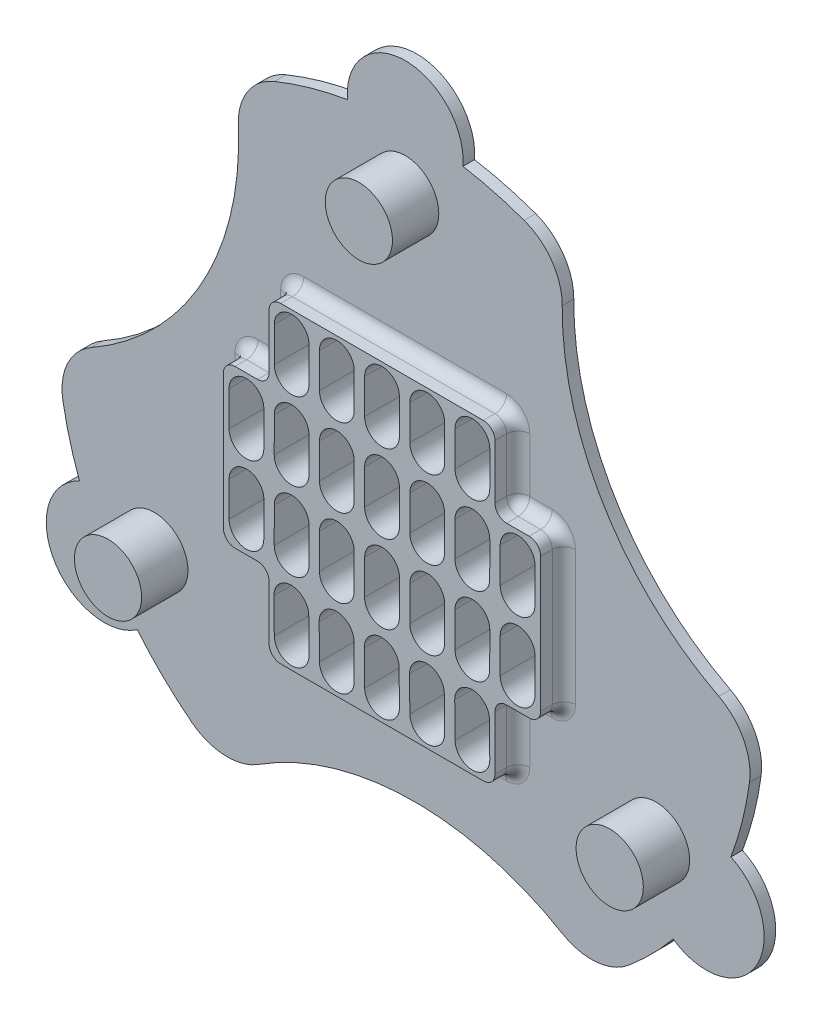
from build123d import *

# Parameters (mm, degrees)
SKETCH2_R           = 18.85
BOSS_EXTRUDE1_DEPTH = 1
SKETCH3_R           = 30
SKETCH3_R_2         = 17.600030795
BOSS_EXTRUDE2_DEPTH = 1
SKETCH4_R           = 2.9
BOSS_EXTRUDE3_DEPTH = 4
SKETCH6_R           = 5
BOSS_EXTRUDE4_DEPTH = 1
SKETCH7_R           = 25
CUT_EXTRUDE2_DEPTH  = 1
FILLET1_R           = 5
SKETCH2_2_R         = 18.85
BOSS_EXTRUDE5_DEPTH = 3
SKETCH8_R           = 20.511068925
CUT_EXTRUDE3_DEPTH  = 2
FILLET2_R           = 1
FILLET3_R           = 1


with BuildPart() as part:
    # Sketch2 → Boss-Extrude1 (new body)
    with BuildSketch(Plane.XY.offset(10)):
        Circle(SKETCH2_R)
        with BuildLine():
            Line((-6.300750604, 11.631897337), (-6.301949779, 8.631897576))
            ThreePointArc((-6.301949779, 8.631897576), (-7.802549247, 7.132497284), (-9.30194954, 8.633096752))
            Line((-9.30194954, 8.633096752), (-9.300750364, 11.633096512))
            ThreePointArc((-9.300750364, 11.633096512), (-7.800150896, 13.132496805), (-6.300750604, 11.631897337))
        make_face(mode=Mode.SUBTRACT)
        with BuildLine():
            Line((-5.400750364, 11.633096512), (-5.40194954, 8.633096752))
            ThreePointArc((-5.40194954, 8.633096752), (-3.902549247, 7.132497284), (-2.401949779, 8.631897576))
            Line((-2.401949779, 8.631897576), (-2.400750604, 11.631897337))
            ThreePointArc((-2.400750604, 11.631897337), (-3.900150896, 13.132496805), (-5.400750364, 11.633096512))
        make_face(mode=Mode.SUBTRACT)
        with BuildLine():
            Line((-1.500750364, 11.633096512), (-1.50194954, 8.633096752))
            ThreePointArc((-1.50194954, 8.633096752), (-0.002549247, 7.132497284), (1.498050221, 8.631897576))
            Line((1.498050221, 8.631897576), (1.499249396, 11.631897337))
            ThreePointArc((1.499249396, 11.631897337), (-0.000150896, 13.132496805), (-1.500750364, 11.633096512))
        make_face(mode=Mode.SUBTRACT)
        with BuildLine():
            Line((2.399249636, 11.633096512), (2.39805046, 8.633096752))
            ThreePointArc((2.39805046, 8.633096752), (3.897450753, 7.132497284), (5.398050221, 8.631897576))
            Line((5.398050221, 8.631897576), (5.399249396, 11.631897337))
            ThreePointArc((5.399249396, 11.631897337), (3.899849104, 13.132496805), (2.399249636, 11.633096512))
        make_face(mode=Mode.SUBTRACT)
        with BuildLine():
            Line((6.299249636, 11.633096512), (6.29805046, 8.633096752))
            ThreePointArc((6.29805046, 8.633096752), (7.797450753, 7.132497284), (9.298050221, 8.631897576))
            Line((9.298050221, 8.631897576), (9.299249396, 11.631897337))
            ThreePointArc((9.299249396, 11.631897337), (7.799849104, 13.132496805), (6.299249636, 11.633096512))
        make_face(mode=Mode.SUBTRACT)
        with BuildLine():
            Line((-10.203450815, 1.876748439), (-10.201950263, 4.876748439))
            ThreePointArc((-10.201950263, 4.876748439), (-11.701199799, 6.377498527), (-13.201949888, 4.878248991))
            Line((-13.201949888, 4.878248991), (-13.20345044, 1.878248991))
            ThreePointArc((-13.20345044, 1.878248991), (-11.704200903, 0.377498902), (-10.203450815, 1.876748439))
        make_face(mode=Mode.SUBTRACT)
        with BuildLine():
            Line((-9.303450024, 1.878248991), (-9.301949472, 4.878248991))
            ThreePointArc((-9.301949472, 4.878248991), (-7.801199384, 6.377498527), (-6.301949847, 4.876748439))
            Line((-6.301949847, 4.876748439), (-6.3034504, 1.876748439))
            ThreePointArc((-6.3034504, 1.876748439), (-7.804200488, 0.377498902), (-9.303450024, 1.878248991))
        make_face(mode=Mode.SUBTRACT)
        with BuildLine():
            Line((-2.4034504, 1.876748439), (-2.401949847, 4.876748439))
            ThreePointArc((-2.401949847, 4.876748439), (-3.901199384, 6.377498527), (-5.401949472, 4.878248991))
            Line((-5.401949472, 4.878248991), (-5.403450024, 1.878248991))
            ThreePointArc((-5.403450024, 1.878248991), (-3.904200488, 0.377498902), (-2.4034504, 1.876748439))
        make_face(mode=Mode.SUBTRACT)
        with BuildLine():
            Line((1.4965496, 1.876748439), (1.498050153, 4.876748439))
            ThreePointArc((1.498050153, 4.876748439), (-0.001199384, 6.377498527), (-1.501949472, 4.878248991))
            Line((-1.501949472, 4.878248991), (-1.503450024, 1.878248991))
            ThreePointArc((-1.503450024, 1.878248991), (-0.004200488, 0.377498902), (1.4965496, 1.876748439))
        make_face(mode=Mode.SUBTRACT)
        with BuildLine():
            Line((5.3965496, 1.876748439), (5.398050153, 4.876748439))
            ThreePointArc((5.398050153, 4.876748439), (3.898800616, 6.377498527), (2.398050528, 4.878248991))
            Line((2.398050528, 4.878248991), (2.396549976, 1.878248991))
            ThreePointArc((2.396549976, 1.878248991), (3.895799512, 0.377498902), (5.3965496, 1.876748439))
        make_face(mode=Mode.SUBTRACT)
        with BuildLine():
            Line((9.2965496, 1.876748439), (9.298050153, 4.876748439))
            ThreePointArc((9.298050153, 4.876748439), (7.798800616, 6.377498527), (6.298050528, 4.878248991))
            Line((6.298050528, 4.878248991), (6.296549976, 1.878248991))
            ThreePointArc((6.296549976, 1.878248991), (7.795799512, 0.377498902), (9.2965496, 1.876748439))
        make_face(mode=Mode.SUBTRACT)
        with BuildLine():
            Line((13.1965496, 1.876748439), (13.198050153, 4.876748439))
            ThreePointArc((13.198050153, 4.876748439), (11.698800616, 6.377498527), (10.198050528, 4.878248991))
            Line((10.198050528, 4.878248991), (10.196549976, 1.878248991))
            ThreePointArc((10.196549976, 1.878248991), (11.695799512, 0.377498902), (13.1965496, 1.876748439))
        make_face(mode=Mode.SUBTRACT)
        with BuildLine():
            Line((-9.304647729, -4.877109305), (-9.30074961, -1.877109305))
            ThreePointArc((-9.30074961, -1.877109305), (-7.798801818, -0.37905963), (-6.300752142, -1.881007421))
            Line((-6.300752142, -1.881007421), (-6.304650262, -4.881007421))
            ThreePointArc((-6.304650262, -4.881007421), (-7.806598054, -6.379057097), (-9.304647729, -4.877109305))
        make_face(mode=Mode.SUBTRACT)
        with BuildLine():
            Line((-2.404650262, -4.881007421), (-2.400752142, -1.881007421))
            ThreePointArc((-2.400752142, -1.881007421), (-3.898801818, -0.37905963), (-5.40074961, -1.877109305))
            Line((-5.40074961, -1.877109305), (-5.404647729, -4.877109305))
            ThreePointArc((-5.404647729, -4.877109305), (-3.906598054, -6.379057097), (-2.404650262, -4.881007421))
        make_face(mode=Mode.SUBTRACT)
        with BuildLine():
            Line((1.495349738, -4.881007421), (1.499247858, -1.881007421))
            ThreePointArc((1.499247858, -1.881007421), (0.001198182, -0.37905963), (-1.50074961, -1.877109305))
            Line((-1.50074961, -1.877109305), (-1.504647729, -4.877109305))
            ThreePointArc((-1.504647729, -4.877109305), (-0.006598054, -6.379057097), (1.495349738, -4.881007421))
        make_face(mode=Mode.SUBTRACT)
        with BuildLine():
            Line((5.395349738, -4.881007421), (5.399247858, -1.881007421))
            ThreePointArc((5.399247858, -1.881007421), (3.901198182, -0.37905963), (2.39925039, -1.877109305))
            Line((2.39925039, -1.877109305), (2.395352271, -4.877109305))
            ThreePointArc((2.395352271, -4.877109305), (3.893401946, -6.379057097), (5.395349738, -4.881007421))
        make_face(mode=Mode.SUBTRACT)
        with BuildLine():
            Line((9.295349738, -4.881007421), (9.299247858, -1.881007421))
            ThreePointArc((9.299247858, -1.881007421), (7.801198182, -0.37905963), (6.29925039, -1.877109305))
            Line((6.29925039, -1.877109305), (6.295352271, -4.877109305))
            ThreePointArc((6.295352271, -4.877109305), (7.793401946, -6.379057097), (9.295349738, -4.881007421))
        make_face(mode=Mode.SUBTRACT)
        with BuildLine():
            Line((13.195349738, -4.881007421), (13.199247858, -1.881007421))
            ThreePointArc((13.199247858, -1.881007421), (11.701198182, -0.37905963), (10.19925039, -1.877109305))
            Line((10.19925039, -1.877109305), (10.195352271, -4.877109305))
            ThreePointArc((10.195352271, -4.877109305), (11.693401946, -6.379057097), (13.195349738, -4.881007421))
        make_face(mode=Mode.SUBTRACT)
        with BuildLine():
            Line((-10.204650262, -4.881007421), (-10.200752142, -1.881007421))
            ThreePointArc((-10.200752142, -1.881007421), (-11.698801818, -0.37905963), (-13.20074961, -1.877109305))
            Line((-13.20074961, -1.877109305), (-13.204647729, -4.877109305))
            ThreePointArc((-13.204647729, -4.877109305), (-11.706598054, -6.379057097), (-10.204650262, -4.881007421))
        make_face(mode=Mode.SUBTRACT)
        with BuildLine():
            Line((-6.325942117, -8.623046013), (-6.300802019, -11.623046013))
            ThreePointArc((-6.300802019, -11.623046013), (-7.788179745, -13.135562955), (-9.300696687, -11.648185229))
            Line((-9.300696687, -11.648185229), (-9.325836785, -8.648185229))
            ThreePointArc((-9.325836785, -8.648185229), (-7.838459059, -7.135668287), (-6.325942117, -8.623046013))
        make_face(mode=Mode.SUBTRACT)
        with BuildLine():
            Line((-5.425836785, -8.648185229), (-5.400696687, -11.648185229))
            ThreePointArc((-5.400696687, -11.648185229), (-3.888179745, -13.135562955), (-2.400802019, -11.623046013))
            Line((-2.400802019, -11.623046013), (-2.425942117, -8.623046013))
            ThreePointArc((-2.425942117, -8.623046013), (-3.938459059, -7.135668287), (-5.425836785, -8.648185229))
        make_face(mode=Mode.SUBTRACT)
        with BuildLine():
            Line((-1.525836785, -8.648185229), (-1.500696687, -11.648185229))
            ThreePointArc((-1.500696687, -11.648185229), (0.011820255, -13.135562955), (1.499197981, -11.623046013))
            Line((1.499197981, -11.623046013), (1.474057883, -8.623046013))
            ThreePointArc((1.474057883, -8.623046013), (-0.038459059, -7.135668287), (-1.525836785, -8.648185229))
        make_face(mode=Mode.SUBTRACT)
        with BuildLine():
            Line((2.374163215, -8.648185229), (2.399303313, -11.648185229))
            ThreePointArc((2.399303313, -11.648185229), (3.911820255, -13.135562955), (5.399197981, -11.623046013))
            Line((5.399197981, -11.623046013), (5.374057883, -8.623046013))
            ThreePointArc((5.374057883, -8.623046013), (3.861540941, -7.135668287), (2.374163215, -8.648185229))
        make_face(mode=Mode.SUBTRACT)
        with BuildLine():
            Line((6.274163215, -8.648185229), (6.299303313, -11.648185229))
            ThreePointArc((6.299303313, -11.648185229), (7.811820255, -13.135562955), (9.299197981, -11.623046013))
            Line((9.299197981, -11.623046013), (9.274057883, -8.623046013))
            ThreePointArc((9.274057883, -8.623046013), (7.761540941, -7.135668287), (6.274163215, -8.648185229))
        make_face(mode=Mode.SUBTRACT)
    extrude(amount=BOSS_EXTRUDE1_DEPTH)

    # Sketch3 → Boss-Extrude2 (add)
    with BuildSketch(Plane.XY.offset(11)):
        Circle(SKETCH3_R)
        Circle(SKETCH3_R_2, mode=Mode.SUBTRACT)
    extrude(amount=-BOSS_EXTRUDE2_DEPTH)

    # Sketch4 → Boss-Extrude3 (add)
    with BuildSketch(Plane.XY.offset(11)):
        with Locations((0, 25)):
            Circle(SKETCH4_R)
        with Locations((21.650635095, -12.5)):
            Circle(SKETCH4_R)
        with Locations((-21.650635095, -12.5)):
            Circle(SKETCH4_R)
    extrude(amount=BOSS_EXTRUDE3_DEPTH)

    # Sketch6 → Boss-Extrude4 (add)
    with BuildSketch(Plane(origin=(0, 0, 10), x_dir=(-1, 0, 0), z_dir=(0, 0, -1))):
        with Locations((0, 30)):
            Circle(SKETCH6_R)
        with Locations((25.980762114, -15)):
            Circle(SKETCH6_R)
        with Locations((-25.980762114, -15)):
            Circle(SKETCH6_R)
    extrude(amount=-BOSS_EXTRUDE4_DEPTH)

    # Sketch7 → Cut-Extrude2 (cut)
    with BuildSketch(Plane(origin=(0, 0, 10), x_dir=(-1, 0, 0), z_dir=(0, 0, -1))):
        with Locations((-38.550089681, 23.214017006)):
            Circle(SKETCH7_R)
        with Locations((39.378973292, 21.778348479)):
            Circle(SKETCH7_R)
        with Locations((-0.828883611, -44.992365485)):
            Circle(SKETCH7_R)
    extrude(amount=-CUT_EXTRUDE2_DEPTH, mode=Mode.SUBTRACT)

    # Fillet1
    fillet1_edges = [part.edges().sort_by_distance(p)[0] for p in [
        (-14.758617972, 26.118636939, 10.5),
        (-29.968117125, -1.382734963, 10.5),
        (-15.240094116, -25.840656558, 10.5),
        (16.181542167, -25.261783252, 10.5),
        (29.998712087, -0.277980381, 10.5),
        (13.786574958, 26.644518215, 10.5),
    ]]
    fillet(fillet1_edges, radius=FILLET1_R)

    # Sketch2<2> → Boss-Extrude5 (add)
    with BuildSketch(Plane.XY.offset(10)):
        Circle(SKETCH2_2_R)
        with BuildLine():
            Line((-6.300750604, 11.631897337), (-6.301949779, 8.631897576))
            ThreePointArc((-6.301949779, 8.631897576), (-7.802549247, 7.132497284), (-9.30194954, 8.633096752))
            Line((-9.30194954, 8.633096752), (-9.300750364, 11.633096512))
            ThreePointArc((-9.300750364, 11.633096512), (-7.800150896, 13.132496805), (-6.300750604, 11.631897337))
        make_face(mode=Mode.SUBTRACT)
        with BuildLine():
            Line((-5.400750364, 11.633096512), (-5.40194954, 8.633096752))
            ThreePointArc((-5.40194954, 8.633096752), (-3.902549247, 7.132497284), (-2.401949779, 8.631897576))
            Line((-2.401949779, 8.631897576), (-2.400750604, 11.631897337))
            ThreePointArc((-2.400750604, 11.631897337), (-3.900150896, 13.132496805), (-5.400750364, 11.633096512))
        make_face(mode=Mode.SUBTRACT)
        with BuildLine():
            Line((-1.500750364, 11.633096512), (-1.50194954, 8.633096752))
            ThreePointArc((-1.50194954, 8.633096752), (-0.002549247, 7.132497284), (1.498050221, 8.631897576))
            Line((1.498050221, 8.631897576), (1.499249396, 11.631897337))
            ThreePointArc((1.499249396, 11.631897337), (-0.000150896, 13.132496805), (-1.500750364, 11.633096512))
        make_face(mode=Mode.SUBTRACT)
        with BuildLine():
            Line((2.399249636, 11.633096512), (2.39805046, 8.633096752))
            ThreePointArc((2.39805046, 8.633096752), (3.897450753, 7.132497284), (5.398050221, 8.631897576))
            Line((5.398050221, 8.631897576), (5.399249396, 11.631897337))
            ThreePointArc((5.399249396, 11.631897337), (3.899849104, 13.132496805), (2.399249636, 11.633096512))
        make_face(mode=Mode.SUBTRACT)
        with BuildLine():
            Line((6.299249636, 11.633096512), (6.29805046, 8.633096752))
            ThreePointArc((6.29805046, 8.633096752), (7.797450753, 7.132497284), (9.298050221, 8.631897576))
            Line((9.298050221, 8.631897576), (9.299249396, 11.631897337))
            ThreePointArc((9.299249396, 11.631897337), (7.799849104, 13.132496805), (6.299249636, 11.633096512))
        make_face(mode=Mode.SUBTRACT)
        with BuildLine():
            Line((-10.203450815, 1.876748439), (-10.201950263, 4.876748439))
            ThreePointArc((-10.201950263, 4.876748439), (-11.701199799, 6.377498527), (-13.201949888, 4.878248991))
            Line((-13.201949888, 4.878248991), (-13.20345044, 1.878248991))
            ThreePointArc((-13.20345044, 1.878248991), (-11.704200903, 0.377498902), (-10.203450815, 1.876748439))
        make_face(mode=Mode.SUBTRACT)
        with BuildLine():
            Line((-9.303450024, 1.878248991), (-9.301949472, 4.878248991))
            ThreePointArc((-9.301949472, 4.878248991), (-7.801199384, 6.377498527), (-6.301949847, 4.876748439))
            Line((-6.301949847, 4.876748439), (-6.3034504, 1.876748439))
            ThreePointArc((-6.3034504, 1.876748439), (-7.804200488, 0.377498902), (-9.303450024, 1.878248991))
        make_face(mode=Mode.SUBTRACT)
        with BuildLine():
            Line((-2.4034504, 1.876748439), (-2.401949847, 4.876748439))
            ThreePointArc((-2.401949847, 4.876748439), (-3.901199384, 6.377498527), (-5.401949472, 4.878248991))
            Line((-5.401949472, 4.878248991), (-5.403450024, 1.878248991))
            ThreePointArc((-5.403450024, 1.878248991), (-3.904200488, 0.377498902), (-2.4034504, 1.876748439))
        make_face(mode=Mode.SUBTRACT)
        with BuildLine():
            Line((1.4965496, 1.876748439), (1.498050153, 4.876748439))
            ThreePointArc((1.498050153, 4.876748439), (-0.001199384, 6.377498527), (-1.501949472, 4.878248991))
            Line((-1.501949472, 4.878248991), (-1.503450024, 1.878248991))
            ThreePointArc((-1.503450024, 1.878248991), (-0.004200488, 0.377498902), (1.4965496, 1.876748439))
        make_face(mode=Mode.SUBTRACT)
        with BuildLine():
            Line((5.3965496, 1.876748439), (5.398050153, 4.876748439))
            ThreePointArc((5.398050153, 4.876748439), (3.898800616, 6.377498527), (2.398050528, 4.878248991))
            Line((2.398050528, 4.878248991), (2.396549976, 1.878248991))
            ThreePointArc((2.396549976, 1.878248991), (3.895799512, 0.377498902), (5.3965496, 1.876748439))
        make_face(mode=Mode.SUBTRACT)
        with BuildLine():
            Line((9.2965496, 1.876748439), (9.298050153, 4.876748439))
            ThreePointArc((9.298050153, 4.876748439), (7.798800616, 6.377498527), (6.298050528, 4.878248991))
            Line((6.298050528, 4.878248991), (6.296549976, 1.878248991))
            ThreePointArc((6.296549976, 1.878248991), (7.795799512, 0.377498902), (9.2965496, 1.876748439))
        make_face(mode=Mode.SUBTRACT)
        with BuildLine():
            Line((13.1965496, 1.876748439), (13.198050153, 4.876748439))
            ThreePointArc((13.198050153, 4.876748439), (11.698800616, 6.377498527), (10.198050528, 4.878248991))
            Line((10.198050528, 4.878248991), (10.196549976, 1.878248991))
            ThreePointArc((10.196549976, 1.878248991), (11.695799512, 0.377498902), (13.1965496, 1.876748439))
        make_face(mode=Mode.SUBTRACT)
        with BuildLine():
            Line((-9.304647729, -4.877109305), (-9.30074961, -1.877109305))
            ThreePointArc((-9.30074961, -1.877109305), (-7.798801818, -0.37905963), (-6.300752142, -1.881007421))
            Line((-6.300752142, -1.881007421), (-6.304650262, -4.881007421))
            ThreePointArc((-6.304650262, -4.881007421), (-7.806598054, -6.379057097), (-9.304647729, -4.877109305))
        make_face(mode=Mode.SUBTRACT)
        with BuildLine():
            Line((-2.404650262, -4.881007421), (-2.400752142, -1.881007421))
            ThreePointArc((-2.400752142, -1.881007421), (-3.898801818, -0.37905963), (-5.40074961, -1.877109305))
            Line((-5.40074961, -1.877109305), (-5.404647729, -4.877109305))
            ThreePointArc((-5.404647729, -4.877109305), (-3.906598054, -6.379057097), (-2.404650262, -4.881007421))
        make_face(mode=Mode.SUBTRACT)
        with BuildLine():
            Line((1.495349738, -4.881007421), (1.499247858, -1.881007421))
            ThreePointArc((1.499247858, -1.881007421), (0.001198182, -0.37905963), (-1.50074961, -1.877109305))
            Line((-1.50074961, -1.877109305), (-1.504647729, -4.877109305))
            ThreePointArc((-1.504647729, -4.877109305), (-0.006598054, -6.379057097), (1.495349738, -4.881007421))
        make_face(mode=Mode.SUBTRACT)
        with BuildLine():
            Line((5.395349738, -4.881007421), (5.399247858, -1.881007421))
            ThreePointArc((5.399247858, -1.881007421), (3.901198182, -0.37905963), (2.39925039, -1.877109305))
            Line((2.39925039, -1.877109305), (2.395352271, -4.877109305))
            ThreePointArc((2.395352271, -4.877109305), (3.893401946, -6.379057097), (5.395349738, -4.881007421))
        make_face(mode=Mode.SUBTRACT)
        with BuildLine():
            Line((9.295349738, -4.881007421), (9.299247858, -1.881007421))
            ThreePointArc((9.299247858, -1.881007421), (7.801198182, -0.37905963), (6.29925039, -1.877109305))
            Line((6.29925039, -1.877109305), (6.295352271, -4.877109305))
            ThreePointArc((6.295352271, -4.877109305), (7.793401946, -6.379057097), (9.295349738, -4.881007421))
        make_face(mode=Mode.SUBTRACT)
        with BuildLine():
            Line((13.195349738, -4.881007421), (13.199247858, -1.881007421))
            ThreePointArc((13.199247858, -1.881007421), (11.701198182, -0.37905963), (10.19925039, -1.877109305))
            Line((10.19925039, -1.877109305), (10.195352271, -4.877109305))
            ThreePointArc((10.195352271, -4.877109305), (11.693401946, -6.379057097), (13.195349738, -4.881007421))
        make_face(mode=Mode.SUBTRACT)
        with BuildLine():
            Line((-10.204650262, -4.881007421), (-10.200752142, -1.881007421))
            ThreePointArc((-10.200752142, -1.881007421), (-11.698801818, -0.37905963), (-13.20074961, -1.877109305))
            Line((-13.20074961, -1.877109305), (-13.204647729, -4.877109305))
            ThreePointArc((-13.204647729, -4.877109305), (-11.706598054, -6.379057097), (-10.204650262, -4.881007421))
        make_face(mode=Mode.SUBTRACT)
        with BuildLine():
            Line((-6.325942117, -8.623046013), (-6.300802019, -11.623046013))
            ThreePointArc((-6.300802019, -11.623046013), (-7.788179745, -13.135562955), (-9.300696687, -11.648185229))
            Line((-9.300696687, -11.648185229), (-9.325836785, -8.648185229))
            ThreePointArc((-9.325836785, -8.648185229), (-7.838459059, -7.135668287), (-6.325942117, -8.623046013))
        make_face(mode=Mode.SUBTRACT)
        with BuildLine():
            Line((-5.425836785, -8.648185229), (-5.400696687, -11.648185229))
            ThreePointArc((-5.400696687, -11.648185229), (-3.888179745, -13.135562955), (-2.400802019, -11.623046013))
            Line((-2.400802019, -11.623046013), (-2.425942117, -8.623046013))
            ThreePointArc((-2.425942117, -8.623046013), (-3.938459059, -7.135668287), (-5.425836785, -8.648185229))
        make_face(mode=Mode.SUBTRACT)
        with BuildLine():
            Line((-1.525836785, -8.648185229), (-1.500696687, -11.648185229))
            ThreePointArc((-1.500696687, -11.648185229), (0.011820255, -13.135562955), (1.499197981, -11.623046013))
            Line((1.499197981, -11.623046013), (1.474057883, -8.623046013))
            ThreePointArc((1.474057883, -8.623046013), (-0.038459059, -7.135668287), (-1.525836785, -8.648185229))
        make_face(mode=Mode.SUBTRACT)
        with BuildLine():
            Line((2.374163215, -8.648185229), (2.399303313, -11.648185229))
            ThreePointArc((2.399303313, -11.648185229), (3.911820255, -13.135562955), (5.399197981, -11.623046013))
            Line((5.399197981, -11.623046013), (5.374057883, -8.623046013))
            ThreePointArc((5.374057883, -8.623046013), (3.861540941, -7.135668287), (2.374163215, -8.648185229))
        make_face(mode=Mode.SUBTRACT)
        with BuildLine():
            Line((6.274163215, -8.648185229), (6.299303313, -11.648185229))
            ThreePointArc((6.299303313, -11.648185229), (7.811820255, -13.135562955), (9.299197981, -11.623046013))
            Line((9.299197981, -11.623046013), (9.274057883, -8.623046013))
            ThreePointArc((9.274057883, -8.623046013), (7.761540941, -7.135668287), (6.274163215, -8.648185229))
        make_face(mode=Mode.SUBTRACT)
    extrude(amount=BOSS_EXTRUDE5_DEPTH)

    # Sketch8 → Cut-Extrude3 (cut)
    with BuildSketch(Plane.XY.offset(13)):
        Circle(SKETCH8_R)
        Polygon((-9.74952037, -13.473579653), (-9.74952037, -6.792613611), (-13.695327423, -6.792613611), (-13.695327423, 6.792613611), (-9.74952037, 6.792613611), (-9.74952037, 13.473579653), (9.74952037, 13.473579653), (9.74952037, 6.792613611), (13.695327423, 6.792613611), (13.695327423, -6.792613611), (9.74952037, -6.792613611), (9.74952037, -13.473579653), align=None, mode=Mode.SUBTRACT)
    extrude(amount=-CUT_EXTRUDE3_DEPTH, mode=Mode.SUBTRACT)

    # Fillet2
    fillet2_edges = [part.edges().sort_by_distance(p)[0] for p in [
        (9.74952037, 13.473579653, 12),
        (9.74952037, 6.792613611, 12),
        (13.695327423, 6.792613611, 12),
        (13.695327423, -6.792613611, 12),
        (9.74952037, -6.792613611, 12),
        (9.74952037, -13.473579653, 12),
        (-9.74952037, -13.473579653, 12),
        (-9.74952037, -6.792613611, 12),
        (-13.695327423, -6.792613611, 12),
        (-13.695327423, 6.792613611, 12),
        (-9.74952037, 6.792613611, 12),
        (-9.74952037, 13.473579653, 12),
    ]]
    fillet(fillet2_edges, radius=FILLET2_R)

    # Fillet3
    fillet3_edges = [part.edges().sort_by_distance(p)[0] for p in [
        (-9.456627151, 13.180686434, 11),
        (0, 13.473579653, 11),
        (9.456627151, 13.180686434, 11),
        (9.74952037, 10.133096632, 11),
        (10.042413589, 7.08550683, 11),
        (11.722423897, 6.792613611, 11),
        (13.402434205, 6.499720393, 11),
        (13.695327423, 0, 11),
        (13.402434205, -6.499720393, 11),
        (11.722423897, -6.792613611, 11),
        (10.042413589, -7.08550683, 11),
        (9.74952037, -10.133096632, 11),
        (9.456627151, -13.180686434, 11),
        (0, -13.473579653, 11),
        (-9.456627151, -13.180686434, 11),
        (-9.74952037, -10.133096632, 11),
        (-10.042413589, -7.08550683, 11),
        (-11.722423897, -6.792613611, 11),
        (-13.402434205, -6.499720393, 11),
        (-13.695327423, 0, 11),
        (-13.402434205, 6.499720393, 11),
        (-11.722423897, 6.792613611, 11),
        (-10.042413589, 7.08550683, 11),
        (-9.74952037, 10.133096632, 11),
    ]]
    fillet(fillet3_edges, radius=FILLET3_R)


solid = part.part
